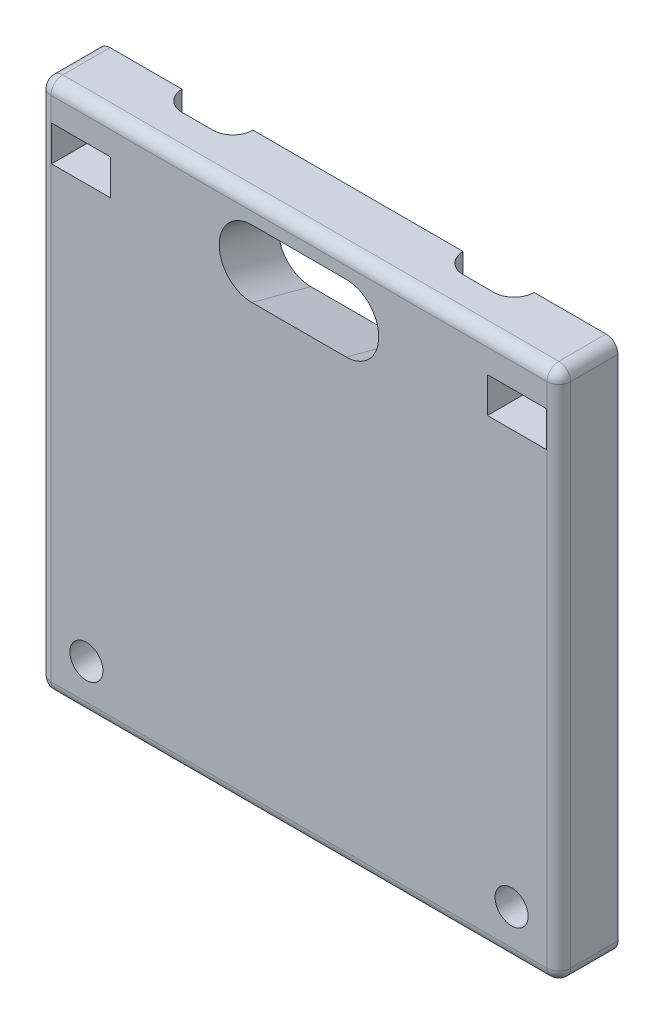
from build123d import *

# Parameters (mm, degrees)
SKETCH1_W                       = 44
SKETCH1_H                       = 45
BASE_DEPTH                      = 5
WIRE_GROOVES_DEPTH              = 51.338851795
SCREW_INSERTION_HOLE_DEPTH      = 33.181634738
SCREW_INSERTION_HOLE_DEPTH_BACK = 33.181634738
SKETCH5_W                       = 5
SKETCH5_H                       = 3
ZIP_TIE_SLOTS_DEPTH             = 32.862987933
SKETCH6_R                       = 1.4
MOUNT_CLAMPING_HOLES_DEPTH      = 32.862987933
EDGE_FILLETS_R                  = 1


with BuildPart() as part:
    # Sketch1 → Base (new body)
    with BuildSketch(Plane.XY):
        Rectangle(SKETCH1_W, SKETCH1_H)
    extrude(amount=BASE_DEPTH)

    # Sketch2 → Wire Grooves (cut, through all)
    with BuildSketch(Plane(origin=(0, 22.5, 0), x_dir=(1, 0, 0), z_dir=(0, 1, 0))):
        with BuildLine():
            Line((-14.9, 0), (-8.9, 0))
            ThreePointArc((-8.9, 0), (-9.397918472, -1.202081528), (-10.6, -1.7))
            Line((-10.6, -1.7), (-13.2, -1.7))
            ThreePointArc((-13.2, -1.7), (-14.402081528, -1.202081528), (-14.9, 0))
        make_face()
        with BuildLine():
            Line((13.2, -1.7), (10.6, -1.7))
            ThreePointArc((10.6, -1.7), (9.397918472, -1.202081528), (8.9, 0))
            Line((8.9, 0), (14.9, 0))
            ThreePointArc((14.9, 0), (14.402081528, -1.202081528), (13.2, -1.7))
        make_face()
    extrude(amount=-WIRE_GROOVES_DEPTH, mode=Mode.SUBTRACT)

    # Sketch3 → Screw Insertion Hole (cut, two sides: drawn at the far end of the back side and taken through both)
    with BuildSketch(Plane(origin=(0, 0.596130014, 4.269237963), x_dir=(-1, 0, 0), z_dir=(0, -0.25881904510252135, -0.9659258262890681)).offset(-SCREW_INSERTION_HOLE_DEPTH_BACK)):
        with BuildLine():
            Line((-4, 19.042473808), (4, 19.042473808))
            ThreePointArc((4, 19.042473808), (6.75, 16.292473808), (4, 13.542473808))
            Line((4, 13.542473808), (-4, 13.542473808))
            ThreePointArc((-4, 13.542473808), (-6.75, 16.292473808), (-4, 19.042473808))
        make_face()
    extrude(amount=SCREW_INSERTION_HOLE_DEPTH + SCREW_INSERTION_HOLE_DEPTH_BACK, mode=Mode.SUBTRACT)

    # Sketch5 → Zip Tie Slots (cut, through all)
    with BuildSketch(Plane(origin=(0, 0, 0), x_dir=(-1, 0, 0), z_dir=(0, 0, -1))):
        with Locations((-18.45, 18)):
            Rectangle(SKETCH5_W, SKETCH5_H)
        with Locations((18.45, 18)):
            Rectangle(SKETCH5_W, SKETCH5_H)
    extrude(amount=-ZIP_TIE_SLOTS_DEPTH, mode=Mode.SUBTRACT)

    # Sketch6 → Mount Clamping Holes (cut, through all)
    with BuildSketch(Plane(origin=(0, 0, 0), x_dir=(-1, 0, 0), z_dir=(0, 0, -1))):
        with Locations((-18, -18.5)):
            Circle(SKETCH6_R)
        with Locations(Location((18, -18.5, 0), (0, 0, 180))):
            Circle(SKETCH6_R)
    extrude(amount=-MOUNT_CLAMPING_HOLES_DEPTH, mode=Mode.SUBTRACT)

    # Edge Fillets
    edge_fillets_edges = [part.edges().sort_by_distance(p)[0] for p in [
        (-22, 0, 5),
        (0, -22.5, 5),
        (22, 0, 5),
        (22, -22.5, 2.5),
        (-22, -22.5, 2.5),
        (-22, 22.5, 2.5),
        (22, 22.5, 2.5),
        (0, 22.5, 5),
    ]]
    fillet(edge_fillets_edges, radius=EDGE_FILLETS_R)


solid = part.part
